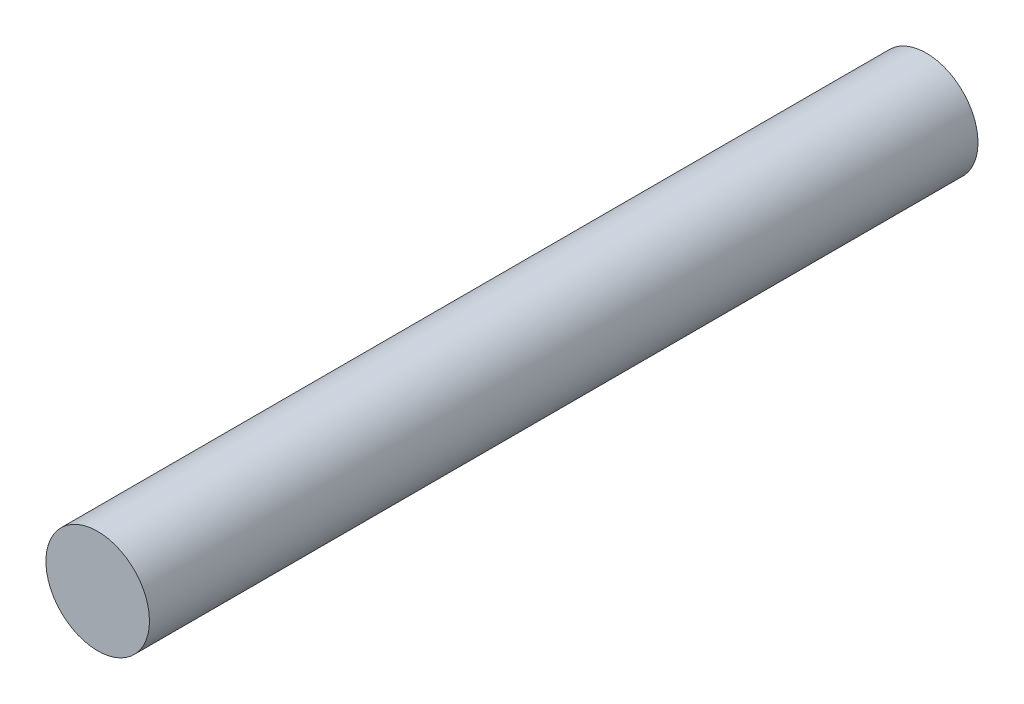
from build123d import *

# Parameters (mm, degrees)
SKETCH2_R           = 1.5875
BOSS_EXTRUDE1_DEPTH = 25.4


with BuildPart() as part:
    # Sketch2 → Boss-Extrude1 (new body)
    with BuildSketch(Plane.XY):
        Circle(SKETCH2_R)
    extrude(amount=-BOSS_EXTRUDE1_DEPTH)


solid = part.part
